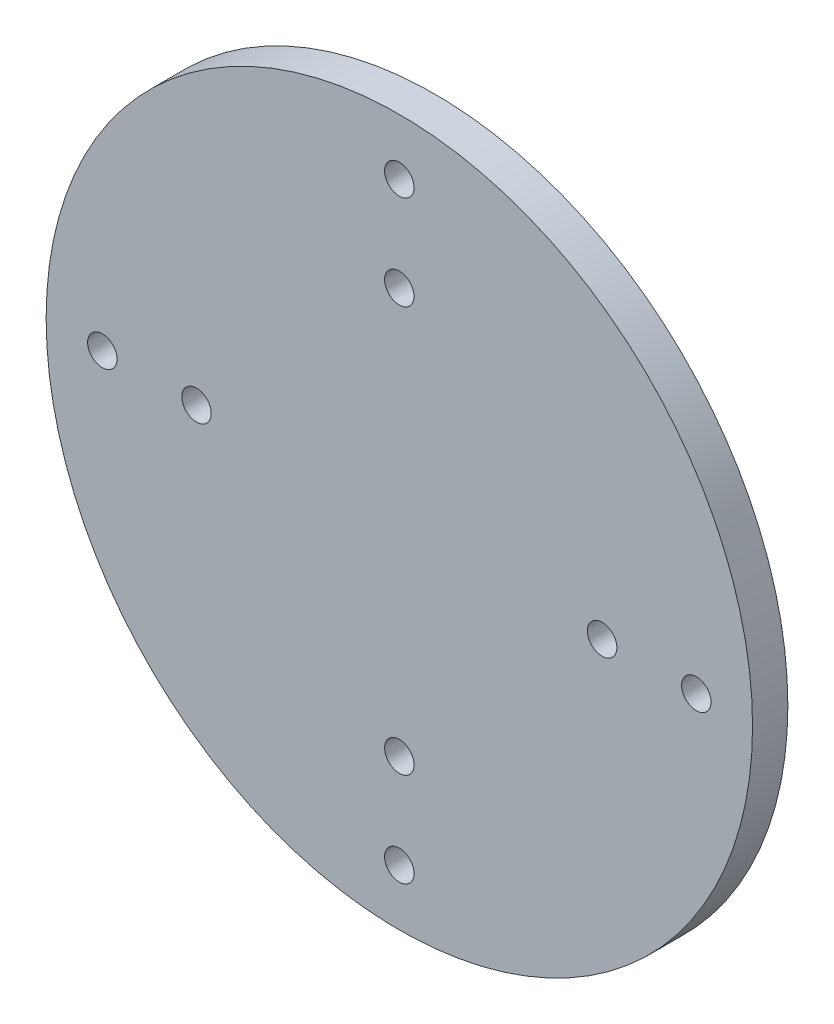
from build123d import *

# Parameters (mm, degrees)
SKETCH1_R           = 30
BOSS_EXTRUDE1_DEPTH = 3
LPATTERN1_COUNT     = 2
LPATTERN1_PITCH     = 8


with BuildPart() as part:
    # Sketch1 → Boss-Extrude1 (new body)
    with BuildSketch(Plane.XY):
        with Locations((124.757462076, 5)):
            Circle(SKETCH1_R)
    extrude(amount=BOSS_EXTRUDE1_DEPTH)

    # Sketch2 → M3 Tapped Hole1 (revolve, cut)
    with BuildSketch(Plane(origin=(107.532834786, 5, 0), x_dir=(0, 1, 0), z_dir=(1, 0, 0))):
        Polygon((0, 0), (0, 8.251075774), (1.25, 7.5), (1.25, 0), align=None)
    m3_tapped_hole1 = revolve(axis=Axis((107.532834786, 5, -6.35), (0, 0, 1)), mode=Mode.SUBTRACT)

    # LPattern1: M3 Tapped Hole1 ×2
    with Locations(*[(-i * LPATTERN1_PITCH, 0, 0) for i in range(1, LPATTERN1_COUNT)]):
        add(m3_tapped_hole1, mode=Mode.SUBTRACT)

    # CirPattern1 copy 1 sketch → CirPattern1 copy 1 (revolve, cut)
    with BuildSketch(Plane(origin=(124.757462076, 30.22462729, 0), x_dir=(1, 0, 0), z_dir=(0, -1, 0))):
        Polygon((0, 0), (0, 8.251075774), (1.25, 7.5), (1.25, 0), align=None)
    revolve(axis=Axis((124.757462076, 30.22462729, -6.35), (0, 0, 1)), mode=Mode.SUBTRACT)

    # CirPattern1 copy 2 sketch → CirPattern1 copy 2 (revolve, cut)
    with BuildSketch(Plane(origin=(149.982089365, 5, 0), x_dir=(0, -1, 0), z_dir=(-1, 0, 0))):
        Polygon((0, 0), (0, 8.251075774), (1.25, 7.5), (1.25, 0), align=None)
    revolve(axis=Axis((149.982089365, 5, -6.35), (0, 0, 1)), mode=Mode.SUBTRACT)

    # CirPattern1 copy 3 sketch → CirPattern1 copy 3 (revolve, cut)
    with BuildSketch(Plane(origin=(124.757462076, -20.22462729, 0), x_dir=(-1, 0, 0), z_dir=(0, 1, 0))):
        Polygon((0, 0), (0, 8.251075774), (1.25, 7.5), (1.25, 0), align=None)
    revolve(axis=Axis((124.757462076, -20.22462729, -6.35), (0, 0, 1)), mode=Mode.SUBTRACT)

    # CirPattern1 copy 4 sketch → CirPattern1 copy 4 (revolve, cut)
    with BuildSketch(Plane(origin=(124.757462076, 22.22462729, 0), x_dir=(1, 0, 0), z_dir=(0, -1, 0))):
        Polygon((0, 0), (0, 8.251075774), (1.25, 7.5), (1.25, 0), align=None)
    revolve(axis=Axis((124.757462076, 22.22462729, -6.35), (0, 0, 1)), mode=Mode.SUBTRACT)

    # CirPattern1 copy 5 sketch → CirPattern1 copy 5 (revolve, cut)
    with BuildSketch(Plane(origin=(141.982089365, 5, 0), x_dir=(0, -1, 0), z_dir=(-1, 0, 0))):
        Polygon((0, 0), (0, 8.251075774), (1.25, 7.5), (1.25, 0), align=None)
    revolve(axis=Axis((141.982089365, 5, -6.35), (0, 0, 1)), mode=Mode.SUBTRACT)

    # CirPattern1 copy 6 sketch → CirPattern1 copy 6 (revolve, cut)
    with BuildSketch(Plane(origin=(124.757462076, -12.22462729, 0), x_dir=(-1, 0, 0), z_dir=(0, 1, 0))):
        Polygon((0, 0), (0, 8.251075774), (1.25, 7.5), (1.25, 0), align=None)
    revolve(axis=Axis((124.757462076, -12.22462729, -6.35), (0, 0, 1)), mode=Mode.SUBTRACT)


solid = part.part
